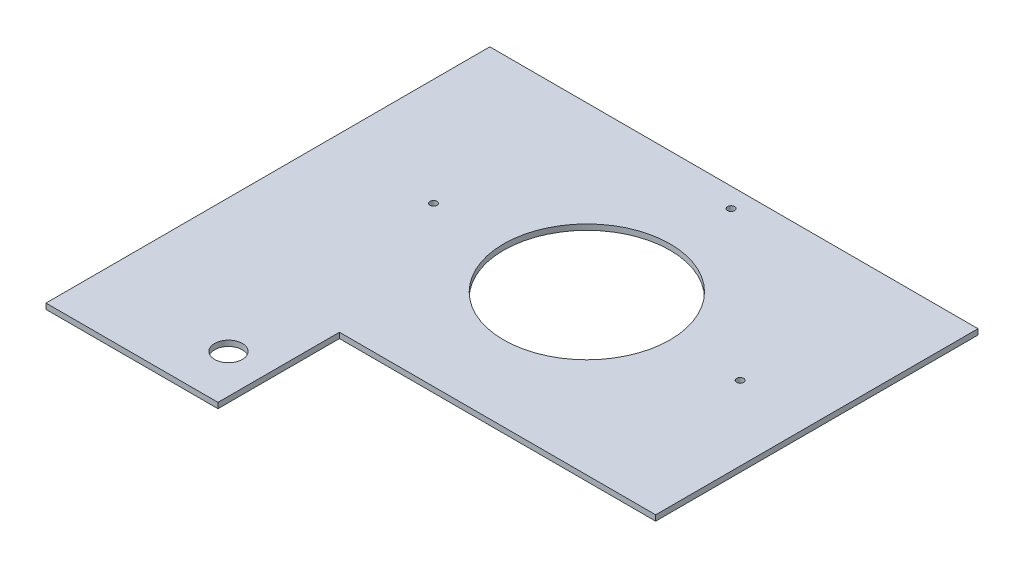
from build123d import *

# Parameters (mm, degrees)
CROQUIS2_R              = 75
CROQUIS2_R_2            = 3.175
CROQUIS2_R_3            = 12.5
SALIENTE_EXTRUIR2_DEPTH = 5


with BuildPart() as part:
    # Croquis2 → Saliente-Extruir2 (new body)
    with BuildSketch(Plane(origin=(0, 0, 0), x_dir=(1, 0, 0), z_dir=(0, 1, 0))):
        Polygon((-164.024069274, 177.568942162), (-164.024069274, -142.431057838), (-164.024069274, -189.256710106), (-164.024069274, -222.426710106), (-79.024069274, -222.426710106), (-9.024069274, -222.426710106), (-9.024069274, -112.958468136), (275.975930726, -112.958468136), (275.975930726, 177.568942162), align=None)
        with Locations(Location((70.975930726, 30.02579809, 0), (0, 0, 270))):
            Circle(CROQUIS2_R, mode=Mode.SUBTRACT)
        with Locations(Location((209.175930726, 30.02579809, 0), (0, 0, 270))):
            Circle(CROQUIS2_R_2, mode=Mode.SUBTRACT)
        with Locations(Location((-67.224069274, 30.02579809, 0), (0, 0, 270))):
            Circle(CROQUIS2_R_2, mode=Mode.SUBTRACT)
        with Locations(Location((70.975930726, 160.02579809, 0), (0, 0, 270))):
            Circle(CROQUIS2_R_2, mode=Mode.SUBTRACT)
        with Locations(Location((-44.024069274, -177.958468136, 0), (0, 0, 270))):
            Circle(CROQUIS2_R_3, mode=Mode.SUBTRACT)
    extrude(amount=SALIENTE_EXTRUIR2_DEPTH)


solid = part.part
